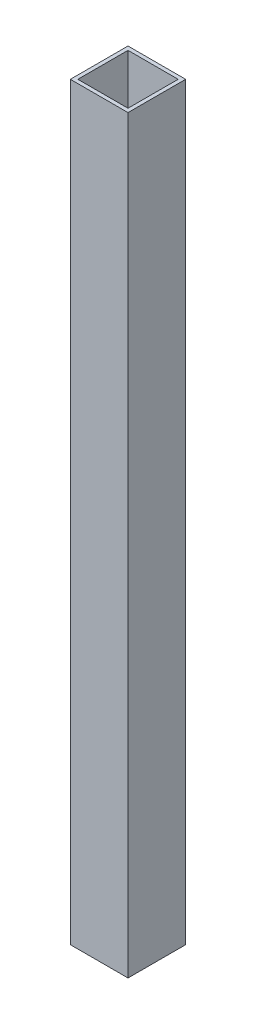
from build123d import *

# Parameters (mm, degrees)
SKETCH1_W           = 25.4
SKETCH1_H           = 25.4
BOSS_EXTRUDE1_DEPTH = 165.1
SKETCH2_W           = 22.098
SKETCH2_H           = 22.098
CUT_EXTRUDE1_DEPTH  = 331.688100784


with BuildPart() as part:
    # Sketch1 → Boss-Extrude1 (new, symmetric)
    with BuildSketch(Plane(origin=(0, 0, 0), x_dir=(1, 0, 0), z_dir=(0, 1, 0))):
        Rectangle(SKETCH1_W, SKETCH1_H)
    extrude(amount=BOSS_EXTRUDE1_DEPTH, both=True)

    # Sketch2 → Cut-Extrude1 (cut, through all)
    with BuildSketch(Plane(origin=(0, 165.1, 0), x_dir=(1, 0, 0), z_dir=(0, 1, 0))):
        Rectangle(SKETCH2_W, SKETCH2_H)
    extrude(amount=-CUT_EXTRUDE1_DEPTH, mode=Mode.SUBTRACT)


solid = part.part
